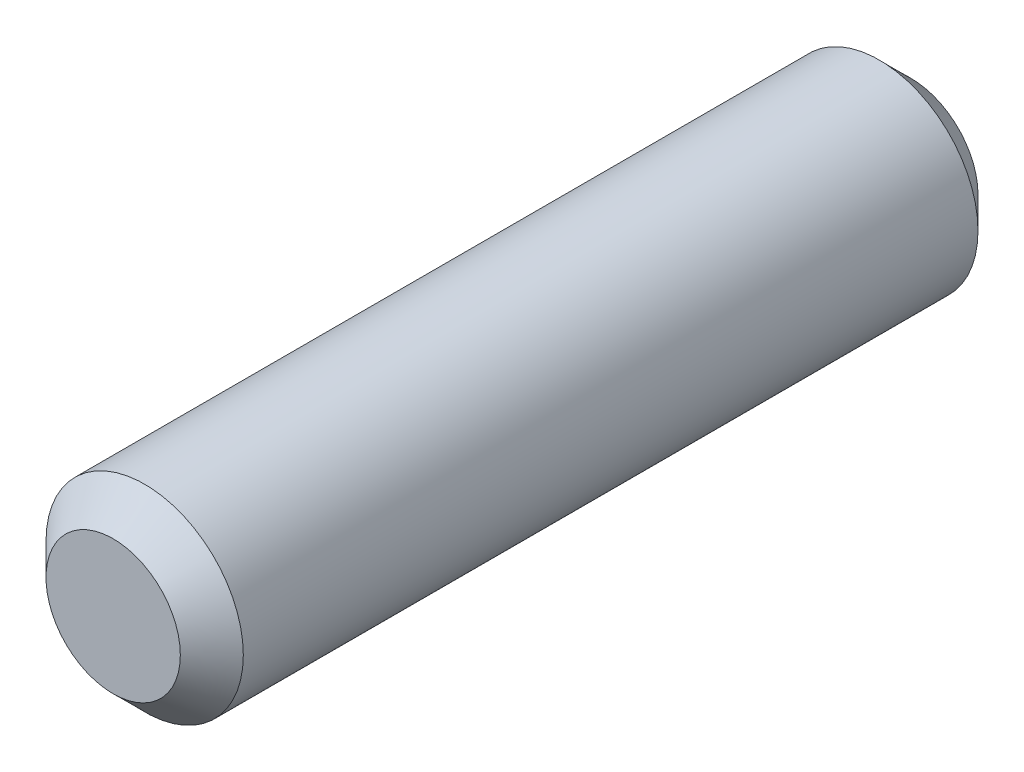
from build123d import *

# Parameters (mm, degrees)
SKETCH1_R           = 2.35
BOSS_EXTRUDE1_DEPTH = 19
FILLET1_SIZE        = 0.75


with BuildPart() as part:
    # Sketch1 → Boss-Extrude1 (new body)
    with BuildSketch(Plane.XY):
        Circle(SKETCH1_R)
    extrude(amount=BOSS_EXTRUDE1_DEPTH)

    # Fillet1
    fillet1_edges = [part.edges().sort_by_distance(p)[0] for p in [
        (-2.35, 0, 0),
        (-2.35, 0, 19),
    ]]
    chamfer(fillet1_edges, length=FILLET1_SIZE)


solid = part.part
